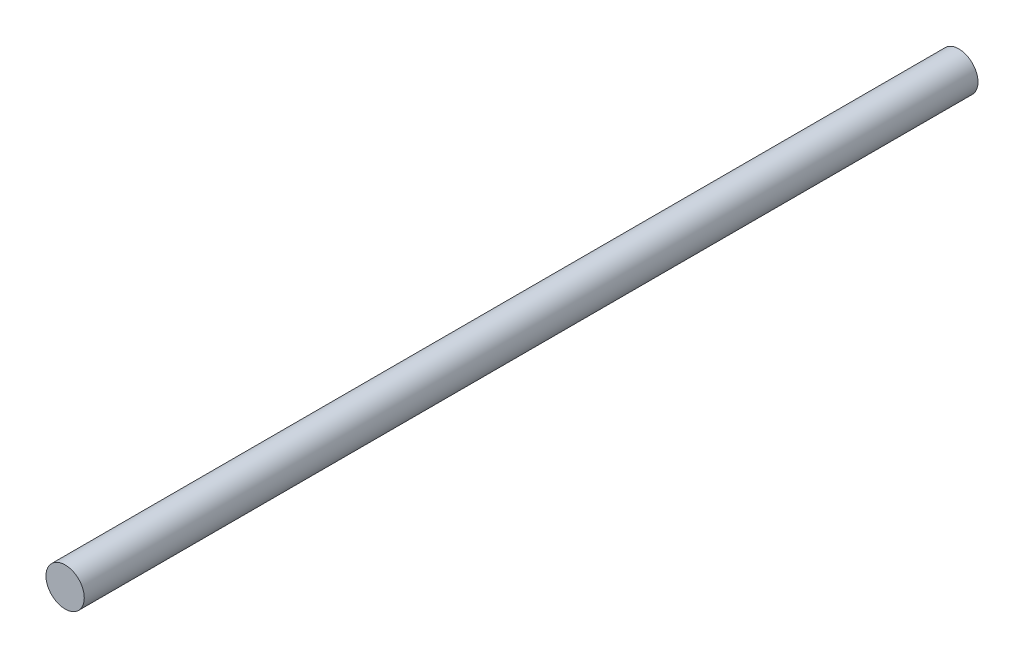
from build123d import *

# Parameters (mm, degrees)
SKETCH_1_R      = 7.5
EXTRUDE_1_DEPTH = 350


with BuildPart() as part:
    # 스케치1 → 보스-돌출1 (new body)
    with BuildSketch(Plane.XY):
        Circle(SKETCH_1_R)
    extrude(amount=EXTRUDE_1_DEPTH)


solid = part.part
